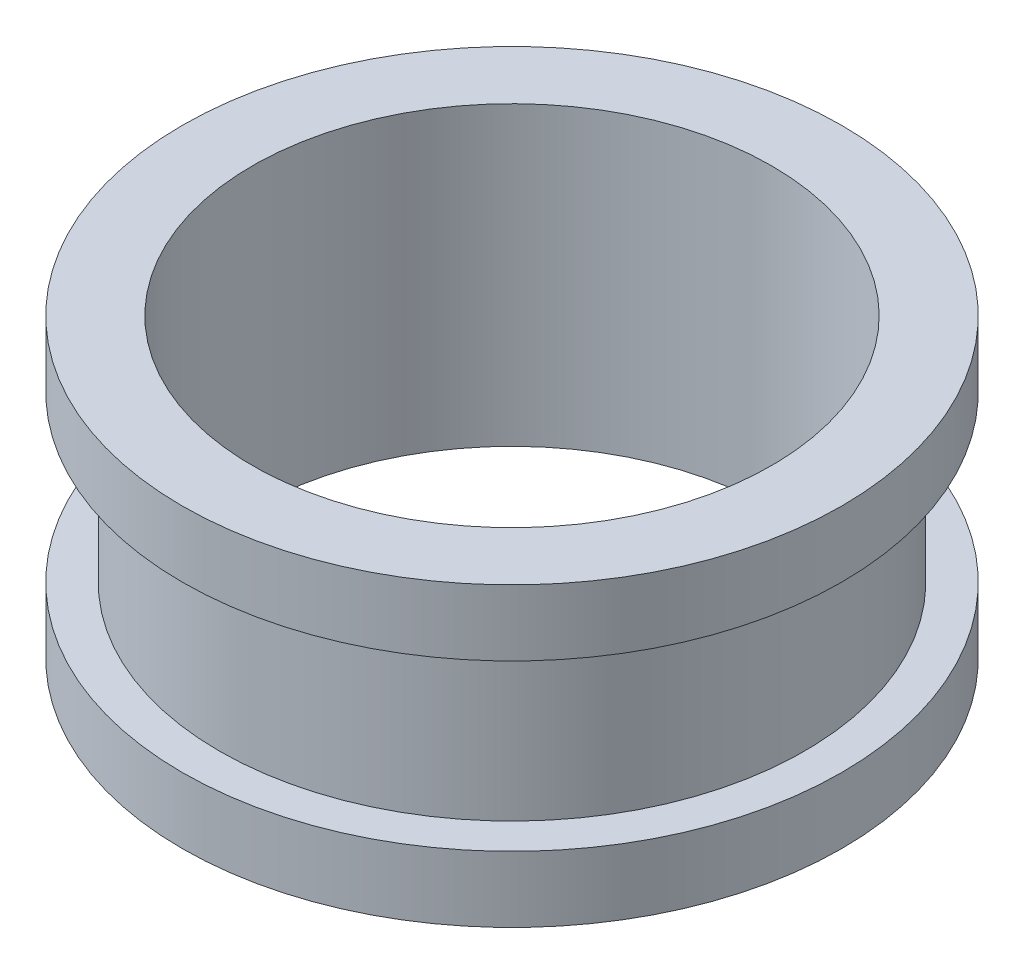
from build123d import *


with BuildPart() as part:
    # Sketch1 → Revolve1 (revolve)
    with BuildSketch(Plane.XY, mode=Mode.PRIVATE) as revolve1_sk:
        Polygon((3.15, -0.8), (3.15, 2.8), (4, 2.8), (4, 2), (3.55, 2), (3.55, 0), (4, 0), (4, -0.8), align=None)
    revolve(revolve1_sk.sketch.rotate(Axis((0, -200, 0), (0, 1, 0)), 90), axis=Axis((0, -200, 0), (0, 1, 0)))


solid = part.part
